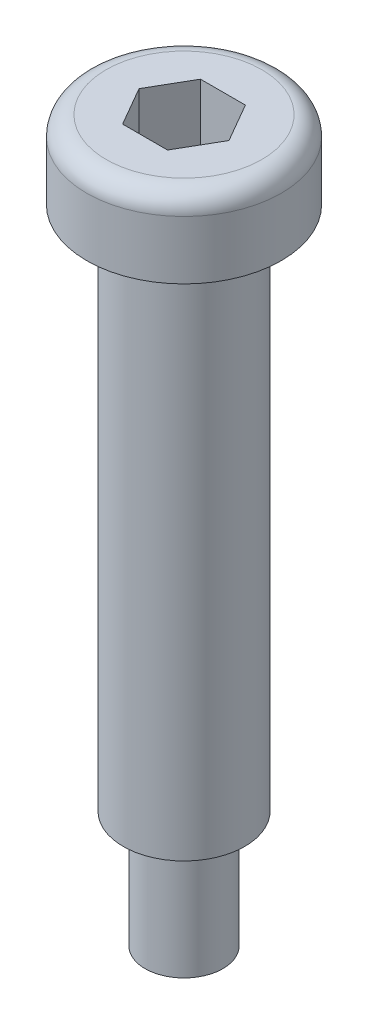
from build123d import *

# Parameters (mm, degrees)
CUT_EXTRUDE1_DEPTH = 3
FILLET1_R          = 1


with BuildPart() as part:
    # Sketch1 → Revolve1 (revolve)
    with BuildSketch(Plane.XY, mode=Mode.PRIVATE) as revolve1_sk:
        Polygon((0, 0), (0, 37), (-5, 37), (-5, 33), (-3.125, 33), (-3.125, 6), (-2, 6), (-2, 0), align=None)
    revolve(revolve1_sk.sketch.rotate(Axis((0, 0, 0), (0, 1, 0)), 270), axis=Axis((0, 0, 0), (0, 1, 0)))

    # Sketch3 → Cut-Extrude1 (cut)
    with BuildSketch(Plane(origin=(0, 37, 0), x_dir=(1, 0, 0), z_dir=(0, 1, 0))):
        Polygon((1.154700538, 2), (-1.154700538, 2), (-2.309401077, 0), (-1.154700538, -2), (1.154700538, -2), (2.309401077, 0), align=None)
    extrude(amount=-CUT_EXTRUDE1_DEPTH, mode=Mode.SUBTRACT)

    # Fillet1
    fillet1_edges = [part.edges().sort_by_distance(p)[0] for p in [
        (0, 37, 5),
    ]]
    fillet(fillet1_edges, radius=FILLET1_R)


solid = part.part
